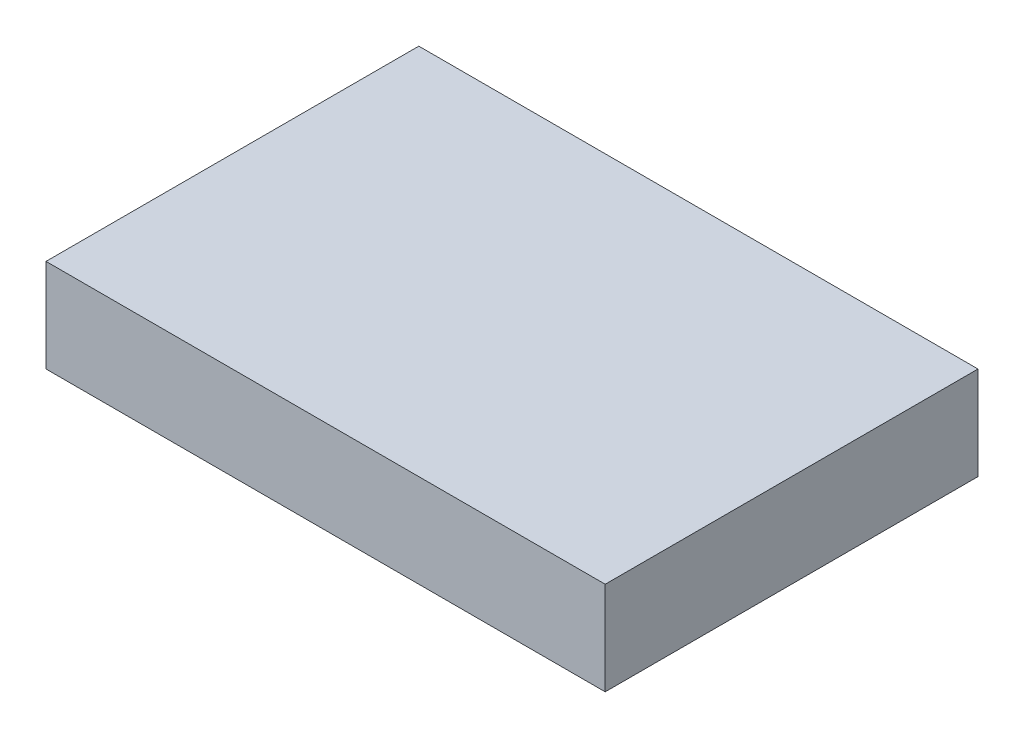
from build123d import *

# Parameters (mm, degrees)
SKETCH1_W           = 76.2
SKETCH1_H           = 50.8
BOSS_EXTRUDE1_DEPTH = 6.35


with BuildPart() as part:
    # Sketch1 → Boss-Extrude1 (new, symmetric)
    with BuildSketch(Plane(origin=(0, 0, 0), x_dir=(1, 0, 0), z_dir=(0, 1, 0))):
        Rectangle(SKETCH1_W, SKETCH1_H)
    extrude(amount=BOSS_EXTRUDE1_DEPTH, both=True)


solid = part.part
